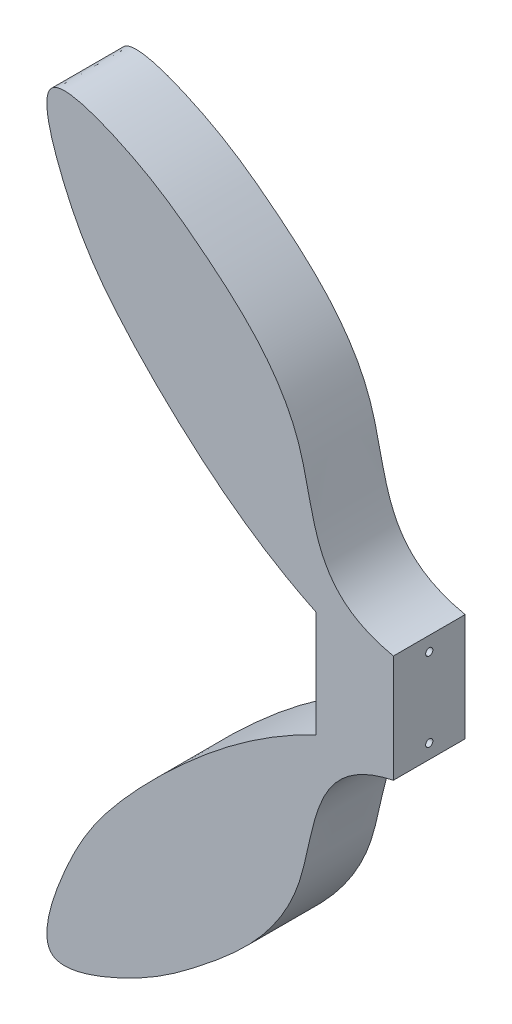
from build123d import *

# Parameters (mm, degrees)
BOSS_EXTRUDE1_DEPTH = 10
SKETCH2_R           = 1
CUT_EXTRUDE1_DEPTH  = 10


with BuildPart() as part:
    # Sketch1 → Boss-Extrude1 (new, symmetric)
    with BuildSketch(Plane.XY):
        with BuildLine():
            Line((15.486624509, 15), (15.486624509, -15))
            add(Edge.make_bspline(
                [(15.486624509, -15), (-8.271493493, -20.026301379), (-4.717450635, -45.552702153), (-20.858125259, -72.34082594), (-39.455077712, -87.953540815), (-55.851725551, -99.680862199), (-86.028455241, -110.848384128), (-75.582294911, -78.26562371), (-63.555303623, -60.49043797), (-39.268039943, -35.67984691), (-20.323732663, -21.646742579), (-6.061504016, -14.810901952)],
                knots=[0, 0, 0, 0, 0.186870654, 0.261406403, 0.356660645, 0.456593384, 0.53130112, 0.612808007, 0.720982893, 0.82029559, 1, 1, 1, 1], degree=3))
            Line((-6.061504016, -14.810901952), (-6.061504016, 14.810901952))
            add(Edge.make_bspline(
                [(15.486624509, 15), (-8.271493493, 20.026301379), (-4.717450635, 45.552702153), (-20.858125259, 72.34082594), (-39.455077712, 87.953540815), (-55.851725551, 99.680862199), (-86.028455241, 110.848384128), (-75.582294911, 78.26562371), (-63.555303623, 60.49043797), (-39.268039943, 35.67984691), (-20.323732663, 21.646742579), (-6.061504016, 14.810901952)],
                knots=[0, 0, 0, 0, 0.186870654, 0.261406403, 0.356660645, 0.456593384, 0.53130112, 0.612808007, 0.720982893, 0.82029559, 1, 1, 1, 1], degree=3))
        make_face()
    extrude(amount=BOSS_EXTRUDE1_DEPTH, both=True)

    # Sketch2 → Cut-Extrude1 (cut)
    with BuildSketch(Plane(origin=(15.486624509, 0, 0), x_dir=(0, 0, -1), z_dir=(1, 0, 0))):
        with Locations((0, 11)):
            Circle(SKETCH2_R)
        with Locations(Location((0, -11, 0), (0, 0, 180))):
            Circle(SKETCH2_R)
    extrude(amount=-CUT_EXTRUDE1_DEPTH, mode=Mode.SUBTRACT)


solid = part.part
